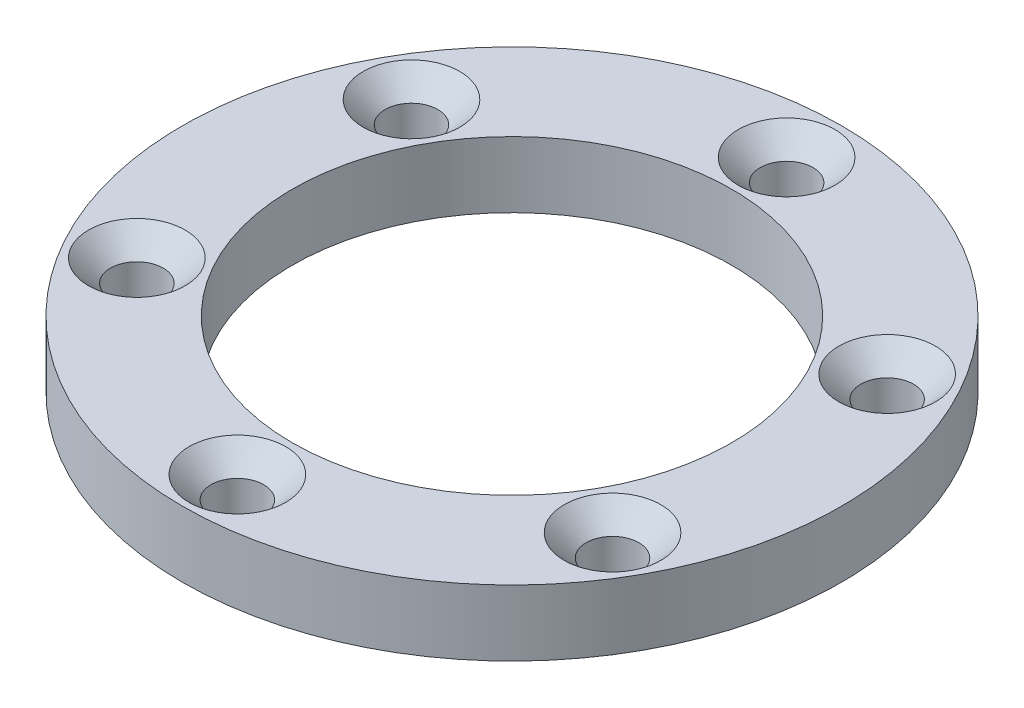
from build123d import *

# Parameters (mm, degrees)
SKETCH1_R                                       = 15
SKETCH1_R_2                                     = 10
BOSS_EXTRUDE1_DEPTH                             = 1.5
CSK_FOR_M2_FLAT_HEAD_MACHINE_SCREW1_D           = 2.4
CSK_FOR_M2_FLAT_HEAD_MACHINE_SCREW1_CSINK_D     = 4.4
CSK_FOR_M2_FLAT_HEAD_MACHINE_SCREW1_CSINK_ANGLE = 90
CIRPATTERN1_COUNT                               = 6


with BuildPart() as part:
    # Sketch1 → Boss-Extrude1 (new, symmetric)
    with BuildSketch(Plane(origin=(0, 0, 0), x_dir=(1, 0, 0), z_dir=(0, 1, 0))):
        with Locations(Location((0, 0, 0), (0, 0, 270))):
            Circle(SKETCH1_R)
        with Locations(Location((0, 0, 0), (0, 0, 270))):
            Circle(SKETCH1_R_2, mode=Mode.SUBTRACT)
    extrude(amount=BOSS_EXTRUDE1_DEPTH, both=True)

    # CSK for M2 Flat Head Machine Screw1 (through all)
    with Locations(Plane(origin=(0, 1.5, -12.5), x_dir=(0, 0, 1), z_dir=(0, 1, 0))):
        with Locations((0, 0)):
            csk_for_m2_flat_head_machine_screw1 = CounterSinkHole(CSK_FOR_M2_FLAT_HEAD_MACHINE_SCREW1_D / 2, CSK_FOR_M2_FLAT_HEAD_MACHINE_SCREW1_CSINK_D / 2, counter_sink_angle=CSK_FOR_M2_FLAT_HEAD_MACHINE_SCREW1_CSINK_ANGLE)

    # CirPattern1: CSK for M2 Flat Head Machine Screw1 ×6 about axis
    cirpattern1_axis = Axis((0, 0, 0), (0, 1, 0))
    for i in range(1, CIRPATTERN1_COUNT):
        add(csk_for_m2_flat_head_machine_screw1.rotate(cirpattern1_axis, i * 360 / CIRPATTERN1_COUNT), mode=Mode.SUBTRACT)


solid = part.part
